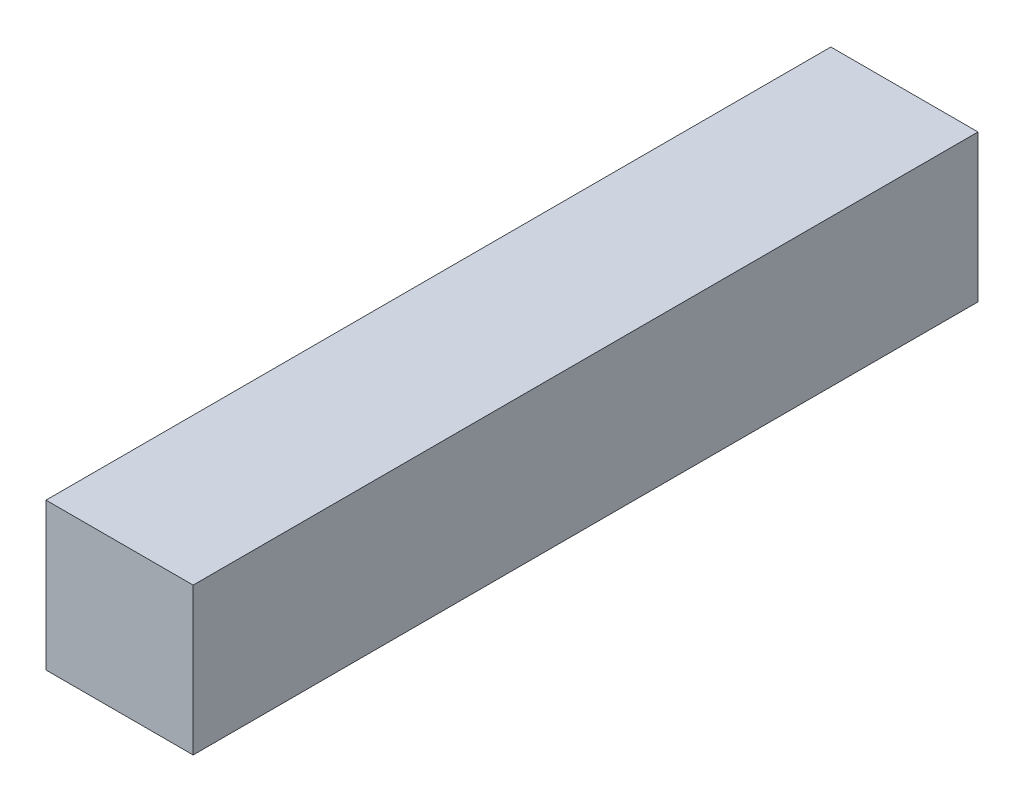
from build123d import *

# Parameters (mm, degrees)
SKETCH1_W           = 4.7625
SKETCH1_H           = 4.7625
BOSS_EXTRUDE1_DEPTH = 12.7


with BuildPart() as part:
    # Sketch1 → Boss-Extrude1 (new, symmetric)
    with BuildSketch(Plane.XY):
        Rectangle(SKETCH1_W, SKETCH1_H)
    extrude(amount=BOSS_EXTRUDE1_DEPTH, both=True)


solid = part.part
